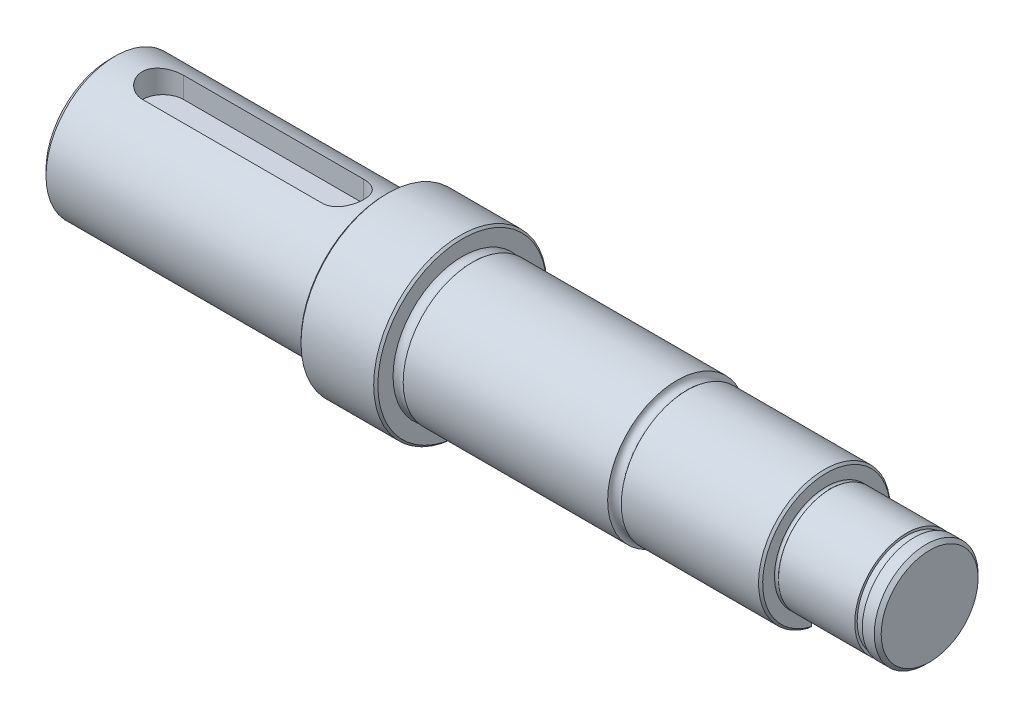
from build123d import *

# Parameters (mm, degrees)
TROU_TARAUD_M61_D       = 5
TROU_TARAUD_M61_DEPTH   = 17
TROU_TARAUD_M61_TIP     = 1.502151548
CHANFREIN1_SIZE         = 1.5
ENL_V_MAT_EXTRU_1_DEPTH = 3.5
ENL_V_MAT_EXTRU_2_DEPTH = 3.5


with BuildPart() as part:
    # Esquisse1 → Révolution1 (revolve)
    with BuildSketch(Plane.XY, mode=Mode.PRIVATE) as r_volution1_sk:
        with BuildLine():
            Line((0, 0), (0, 9.2))
            Line((0, 9.2), (0.8, 10))
            Line((0.8, 10), (38.400261411, 10))
            ThreePointArc((38.400261411, 10), (39.120130705, 9.673388856), (39.84, 10))
            Line((39.84, 10), (39.84, 12.2))
            Line((39.84, 12.2), (40.14, 12.5))
            Line((40.14, 12.5), (50.64, 12.5))
            Line((50.64, 12.5), (50.94, 12.2))
            Line((50.94, 12.2), (50.94, 10))
            ThreePointArc((50.94, 10), (51.671438531, 9.719683242), (52.402877061, 10))
            Line((52.402877061, 10), (81.94, 10))
            ThreePointArc((81.94, 10), (82.497638148, 9.22193079), (83.413623691, 9.5))
            Line((83.413623691, 9.5), (103.24, 9.5))
            Line((103.24, 9.5), (103.54, 9.2))
            Line((103.54, 9.2), (103.54, 7.5))
            ThreePointArc((103.54, 7.5), (103.830256088, 7.31760008), (104.120512177, 7.5))
            Line((104.120512177, 7.5), (115.14, 7.5))
            Line((115.14, 7.5), (115.14, 7.15))
            Line((115.14, 7.15), (116.24, 7.15))
            Line((116.24, 7.15), (116.24, 7.5))
            Line((116.24, 7.5), (117.96, 7.5))
            Line((117.96, 7.5), (118.46, 7))
            Line((118.46, 7), (118.46, 0))
            Line((118.46, 0), (0, 0))
        make_face()
    revolve(r_volution1_sk.sketch.rotate(Axis((-8.681920904, 0, 0), (1, 0, 0)), 90), axis=Axis((-8.681920904, 0, 0), (1, 0, 0)))

    # Trou taraudé M61
    with Locations(Plane.ZY):
        with Locations((0, 0)):
            Hole(TROU_TARAUD_M61_D / 2, depth=TROU_TARAUD_M61_DEPTH)
            with Locations((0, 0, -(TROU_TARAUD_M61_DEPTH + TROU_TARAUD_M61_TIP / 2))):  # 118° drill point
                Cone(0, TROU_TARAUD_M61_D / 2, TROU_TARAUD_M61_TIP, mode=Mode.SUBTRACT)

    # Chanfrein1
    chanfrein1_edges = [part.edges().sort_by_distance(p)[0] for p in [
        (0, 0, 2.5),
    ]]
    chamfer(chanfrein1_edges, length=CHANFREIN1_SIZE)

    # Esquisse8 → Enlèv. mat.-Extru.1 (cut)
    with BuildSketch(Plane(origin=(19.600130705, 10, 0), x_dir=(0, 0, -1), z_dir=(0, 1, 0))):
        with BuildLine():
            Line((3, 11.900130705), (3, -14.099869295))
            ThreePointArc((3, -14.099869295), (0, -17.099869295), (-3, -14.099869295))
            Line((-3, -14.099869295), (-3, 11.900130705))
            ThreePointArc((-3, 11.900130705), (0, 14.900130705), (3, 11.900130705))
        make_face()
    extrude(amount=-ENL_V_MAT_EXTRU_1_DEPTH, mode=Mode.SUBTRACT)

    # Esquisse9 → Enlèv. mat.-Extru.2 (cut)
    with BuildSketch(Plane(origin=(93.326811846, -9.5, 0), x_dir=(0, 0, 1), z_dir=(0, -1, 0))):
        with BuildLine():
            Line((3, 7.886811846), (3, -8.113188154))
            ThreePointArc((3, -8.113188154), (0, -11.113188154), (-3, -8.113188154))
            Line((-3, -8.113188154), (-3, 7.886811846))
            ThreePointArc((-3, 7.886811846), (0, 10.886811846), (3, 7.886811846))
        make_face()
    extrude(amount=-ENL_V_MAT_EXTRU_2_DEPTH, mode=Mode.SUBTRACT)


solid = part.part
